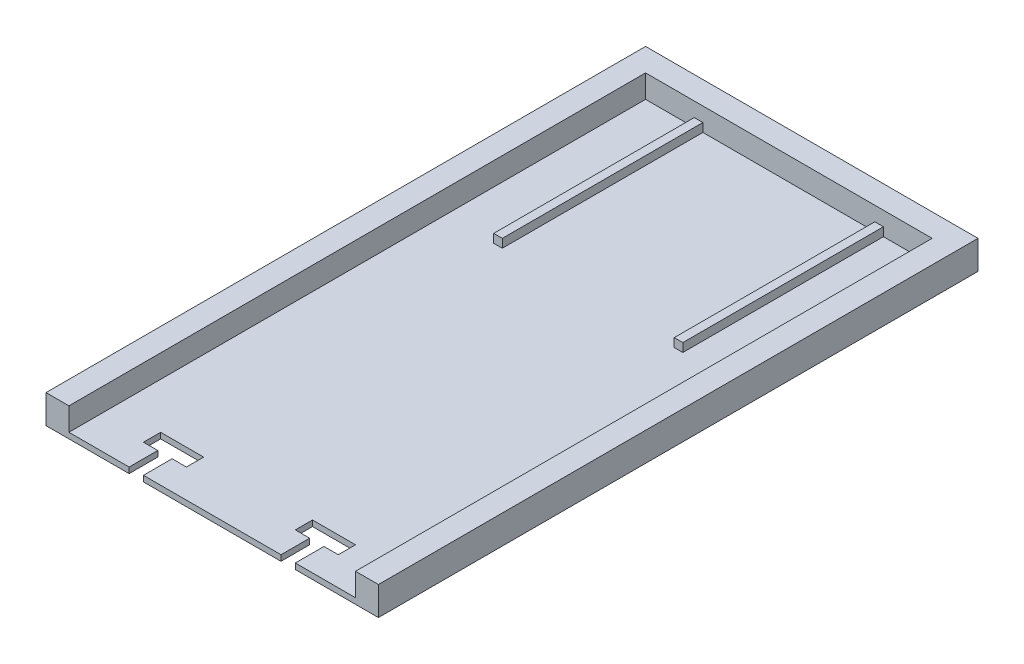
from build123d import *

# Parameters (mm, degrees)
SKETCH3_W               = 116
SKETCH3_H               = 416
BOSS_EXTRUDE1_DEPTH     = 10
SKETCH4_W               = 100
SKETCH4_H               = 400
CUT_EXTRUDE1_DEPTH      = 8
SKETCH6_W               = 3
SKETCH6_H               = 100
BOSS_EXTRUDE4_DEPTH     = 3
SKETCH7_R               = 1.5
BOSS_EXTRUDE5_DEPTH     = 3
CUT_EXTRUDE2_DEPTH      = 10
CUT_EXTRUDE2_DEPTH_BACK = 10
SKETCH8_W               = 116
SKETCH8_H               = 176.78031556
CUT_EXTRUDE4_DEPTH      = 37
CUT_EXTRUDE5_DEPTH      = 10
SKETCH11_W              = 8
SKETCH11_H              = 30
CUT_EXTRUDE6_DEPTH      = 10
SKETCH12_W              = 3
SKETCH12_H              = 30
CUT_EXTRUDE7_DEPTH      = 10
SKETCH13_W              = 3
SKETCH13_H              = 30
CUT_EXTRUDE10_DEPTH     = 14
SKETCH14_W              = 3
SKETCH14_H              = 30
BOSS_EXTRUDE8_DEPTH     = 2


with BuildPart() as part:
    # Sketch3 → Boss-Extrude1 (new body)
    with BuildSketch(Plane(origin=(0, 0, 0), x_dir=(1, 0, 0), z_dir=(0, 1, 0))):
        with Locations((-1098.104867157, 569.267379684)):
            Rectangle(SKETCH3_W, SKETCH3_H)
    extrude(amount=BOSS_EXTRUDE1_DEPTH)

    # Sketch4 → Cut-Extrude1 (cut)
    with BuildSketch(Plane(origin=(0, 10, 0), x_dir=(1, 0, 0), z_dir=(0, 1, 0))):
        with Locations((-1098.104867157, 569.267379684)):
            Rectangle(SKETCH4_W, SKETCH4_H)
    extrude(amount=-CUT_EXTRUDE1_DEPTH, mode=Mode.SUBTRACT)

    # Sketch6 → Boss-Extrude4 (add)
    with BuildSketch(Plane(origin=(0, 2, 0), x_dir=(1, 0, 0), z_dir=(0, 1, 0))):
        with Locations((-1129.604867157, 719.267379684)):
            Rectangle(SKETCH6_W, SKETCH6_H)
        with Locations((-1066.604867157, 719.267379684)):
            Rectangle(SKETCH6_W, SKETCH6_H)
    extrude(amount=BOSS_EXTRUDE4_DEPTH)

    # Sketch7 → Boss-Extrude5 (add)
    with BuildSketch(Plane(origin=(0, 2, 0), x_dir=(1, 0, 0), z_dir=(0, 1, 0))):
        with Locations(Location((-1085.404867157, 452.168271652, 0), (0, 0, 270))):
            Circle(SKETCH7_R)
    extrude(amount=BOSS_EXTRUDE5_DEPTH)

    # Sketch8 → Cut-Extrude2 (cut, two sides: drawn at the far end of the back side and taken through both)
    with BuildSketch(Plane(origin=(0, 2, 0), x_dir=(1, 0, 0), z_dir=(0, 1, 0)).offset(-CUT_EXTRUDE2_DEPTH_BACK)):
        with Locations((-1098.104867157, 449.657537464)):
            Rectangle(SKETCH8_W, SKETCH8_H)
    extrude(amount=CUT_EXTRUDE2_DEPTH + CUT_EXTRUDE2_DEPTH_BACK, mode=Mode.SUBTRACT)

    # Sketch9 → Cut-Extrude4 (cut)
    with BuildSketch(Plane(origin=(0, 2, 0), x_dir=(1, 0, 0), z_dir=(0, 1, 0))):
        Polygon((-1127.104867157, 548.047695244), (-1127.104867157, 538.047695244), (-1122.104867157, 538.047695244), (-1122.104867157, 548.047695244), (-1117.104867157, 548.047695244), (-1117.104867157, 554.047695244), (-1132.104867157, 554.047695244), (-1132.104867157, 548.047695244), align=None)
        Polygon((-1074.104867157, 548.047695244), (-1074.104867157, 538.047695244), (-1069.104867157, 538.047695244), (-1069.104867157, 548.047695244), (-1064.104867157, 548.047695244), (-1064.104867157, 554.047695244), (-1079.104867157, 554.047695244), (-1079.104867157, 548.047695244), align=None)
    extrude(amount=-CUT_EXTRUDE4_DEPTH, mode=Mode.SUBTRACT)

    # Sketch10 → Cut-Extrude5 (cut)
    with BuildSketch(Plane(origin=(0, 5, 0), x_dir=(1, 0, 0), z_dir=(0, 1, 0))):
        Polygon((-1127.104867157, 578.047695244), (-1127.104867157, 568.047695244), (-1122.104867157, 568.047695244), (-1122.104867157, 578.047695244), (-1117.104867157, 578.047695244), (-1117.104867157, 584.047695244), (-1132.104867157, 584.047695244), (-1132.104867157, 578.047695244), align=None)
        Polygon((-1156.104867157, 568.047695244), (-1156.104867157, 538.047695244), (-1040.104867157, 538.047695244), (-1040.104867157, 568.047695244), (-1069.104867157, 568.047695244), (-1074.104867157, 568.047695244), (-1122.104867157, 568.047695244), (-1127.104867157, 568.047695244), align=None)
        Polygon((-1069.104867157, 568.047695244), (-1074.104867157, 568.047695244), (-1074.104867157, 578.047695244), (-1079.104867157, 578.047695244), (-1079.104867157, 584.047695244), (-1064.104867157, 584.047695244), (-1064.104867157, 578.047695244), (-1069.104867157, 578.047695244), align=None)
    extrude(amount=-CUT_EXTRUDE5_DEPTH, mode=Mode.SUBTRACT)

    # Sketch11 → Cut-Extrude6 (cut)
    with BuildSketch(Plane(origin=(0, 0, 0), x_dir=(1, 0, 0), z_dir=(0, 1, 0))):
        with Locations((-1152.104867157, 553.047695244)):
            Rectangle(SKETCH11_W, SKETCH11_H)
        with Locations((-1044.104867157, 553.047695244)):
            Rectangle(SKETCH11_W, SKETCH11_H)
    extrude(amount=CUT_EXTRUDE6_DEPTH, mode=Mode.SUBTRACT)

    # Sketch12 → Cut-Extrude7 (cut)
    with BuildSketch(Plane(origin=(0, 2, 0), x_dir=(1, 0, 0), z_dir=(0, 1, 0))):
        with Locations((-1066.604867157, 684.267379684)):
            Rectangle(SKETCH12_W, SKETCH12_H)
    extrude(amount=CUT_EXTRUDE7_DEPTH, mode=Mode.SUBTRACT)

    # Sketch13 → Cut-Extrude10 (cut)
    with BuildSketch(Plane(origin=(0, 0, 0), x_dir=(1, 0, 0), z_dir=(0, 1, 0))):
        with Locations((-1129.604867157, 684.267379684)):
            Rectangle(SKETCH13_W, SKETCH13_H)
    extrude(amount=CUT_EXTRUDE10_DEPTH, mode=Mode.SUBTRACT)

    # Sketch14 → Boss-Extrude8 (add)
    with BuildSketch(Plane(origin=(0, 0, 0), x_dir=(1, 0, 0), z_dir=(0, 1, 0))):
        with Locations((-1129.604867157, 684.267379684)):
            Rectangle(SKETCH14_W, SKETCH14_H)
    extrude(amount=BOSS_EXTRUDE8_DEPTH)


solid = part.part
